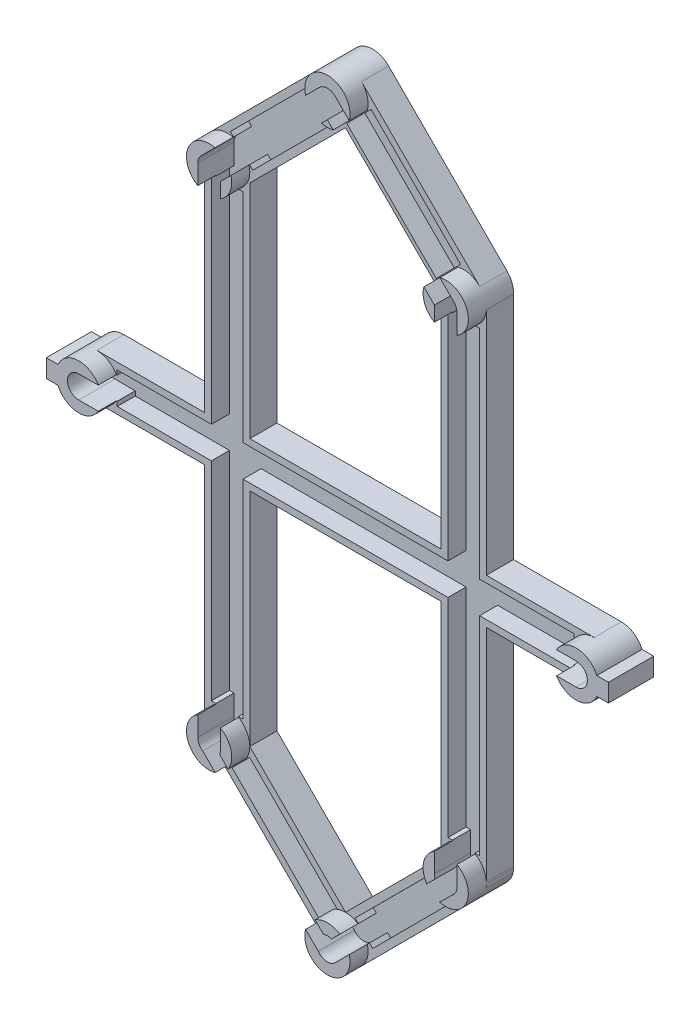
from build123d import *
from build123d.topology import SkipClean

# Parameters (mm, degrees)
SKETCH_1_R                       = 5
SKETCH_1_R_2                     = 2.5
EXTRUDE_1_DEPTH                  = 10
EXTRUDE_1_2_DEPTH                = 10
EXTRUDE_1_3_DEPTH                = 10
EXTRUDE_1_4_DEPTH                = 10
EXTRUDE_1_5_DEPTH                = 10
EXTRUDE_1_6_DEPTH                = 10
EXTRUDE_2_DEPTH                  = 6
EXTRUDE_4_DEPTH                  = 6
CUT_EXTRUDE_1_DEPTH              = 4
SKETCH_5_R                       = 3.75
SKETCH_5_R_2                     = 2.5
EXTRUDE_3_DEPTH                  = 2
CUT_EXTRUDE_2_DEPTH              = 4
CUT_EXTRUDE_3_DEPTH              = 8
SKETCH_11_R                      = 2.5
EXTRUDE_9_DEPTH                  = 2
AUFSATZ_LINEAR_AUSTRAGEN1_DEPTH  = 6
SKIZZE4_W                        = 5
SKIZZE4_H                        = 59.806963929
SCHNITT_LINEAR_AUSTRAGEN1_DEPTH  = 8
SCHNITT_LINEAR_AUSTRAGEN2_DEPTH  = 8
SCHNITT_LINEAR_AUSTRAGEN3_DEPTH  = 8
SCHNITT_LINEAR_AUSTRAGEN6_DEPTH  = 8
SKIZZE9_W                        = 5
SKIZZE9_H                        = 50.316023812
SCHNITT_LINEAR_AUSTRAGEN8_DEPTH  = 8
SCHNITT_LINEAR_START             = -4
SCHNITT_LINEAR_AUSTRAGEN9_DEPTH  = 4
SKIZZE11_W                       = 110
SKIZZE11_H                       = 10
AUFSATZ_LINEAR_AUSTRAGEN2_DEPTH  = 6
SKIZZE12_R                       = 5
SKIZZE12_R_2                     = 2.5
AUFSATZ_LINEAR_AUSTRAGEN4_DEPTH  = 10
SCHNITT_LINEAR_AUSTRAGEN10_DEPTH = 8
AUFSATZ_LINEAR_AUSTRAGEN5_DEPTH  = 2
SKIZZE17_W                       = 3
SKIZZE17_H                       = 4
AUFSATZ_LINEAR_AUSTRAGEN6_DEPTH  = 10
SKIZZE18_W                       = 100.99044
SKIZZE18_H                       = 7
SCHNITT_LINEAR_AUSTRAGEN11_DEPTH = 4
SKIZZE19_W                       = 7
SKIZZE19_H                       = 101
SKIZZE19_W_2                     = 6.995164391
SCHNITT_LINEAR_AUSTRAGEN12_DEPTH = 4
SCHNITT_LINEAR_AUSTRAGEN13_DEPTH = 4
SCHNITT_LINEAR_AUSTRAGEN14_DEPTH = 4


with BuildPart() as part:
    # Эскиз1 → Бобышка-Вытянуть1 (new body)
    with BuildSketch(Plane.XY):
        with Locations((-12.085916667, 54.294857344)):
            Circle(SKETCH_1_R)
        with Locations((-12.085916667, 54.294857344)):
            Circle(SKETCH_1_R_2, mode=Mode.SUBTRACT)
    extrude(amount=EXTRUDE_1_DEPTH)



with BuildPart() as body_2:
    # Эскиз1 → Extrude 1 2 (new body)
    with BuildSketch(Plane.XY):
        with Locations((-38.24886757, 28.13190644)):
            Circle(SKETCH_1_R)
        with Locations((-38.24886757, 28.13190644)):
            Circle(SKETCH_1_R_2, mode=Mode.SUBTRACT)
    extrude(amount=EXTRUDE_1_2_DEPTH)


with BuildPart() as body_3:
    # Эскиз1 → Extrude 1 3 (new body)
    with BuildSketch(Plane.XY):
        with Locations((14.077034237, 28.13190644)):
            Circle(SKETCH_1_R)
        with Locations((14.077034237, 28.13190644)):
            Circle(SKETCH_1_R_2, mode=Mode.SUBTRACT)
    extrude(amount=EXTRUDE_1_3_DEPTH)


with BuildPart() as body_4:
    # Эскиз1 → Extrude 1 4 (new body)
    with BuildSketch(Plane.XY):
        with Locations((-38.24886757, -81.86809356)):
            Circle(SKETCH_1_R)
        with Locations((-38.24886757, -81.86809356)):
            Circle(SKETCH_1_R_2, mode=Mode.SUBTRACT)
    extrude(amount=EXTRUDE_1_4_DEPTH)


with BuildPart() as body_5:
    # Эскиз1 → Extrude 1 5 (new body)
    with BuildSketch(Plane.XY):
        with Locations((14.077034237, -81.86809356)):
            Circle(SKETCH_1_R)
        with Locations((14.077034237, -81.86809356)):
            Circle(SKETCH_1_R_2, mode=Mode.SUBTRACT)
    extrude(amount=EXTRUDE_1_5_DEPTH)


with BuildPart() as body_6:
    # Эскиз1 → Extrude 1 6 (new body)
    with BuildSketch(Plane.XY):
        with Locations((-12.085916667, -108.031044464)):
            Circle(SKETCH_1_R)
        with Locations((-12.085916667, -108.031044464)):
            Circle(SKETCH_1_R_2, mode=Mode.SUBTRACT)
    extrude(amount=EXTRUDE_1_6_DEPTH)


with BuildPart() as part_1:
    add(part.part)

    add(body_2.part)  # Бобышка-Вытянуть2 merges body 2
    # Эскиз3 → Бобышка-Вытянуть2 (add)
    with BuildSketch(Plane(origin=(0, 0, 0), x_dir=(-1, 0, 0), z_dir=(0, 0, -1))):
        Polygon((12.085916667, 54.294857344), (15.621450572, 57.83039125), (41.784401476, 31.667440346), (34.713333665, 24.596372534), (8.550382761, 50.759323438), align=None)
    extrude(amount=-EXTRUDE_2_DEPTH)


    add(body_3.part)  # Бобышка-Вытянуть4 merges body 3
    # Эскиз9 → Бобышка-Вытянуть4 (add)
    with BuildSketch(Plane(origin=(0, 0, 0), x_dir=(-1, 0, 0), z_dir=(0, 0, -1))):
        Polygon((-14.077034237, 28.13190644), (-17.612568143, 31.667440346), (8.550382761, 57.83039125), (15.621450572, 50.759323438), (-10.541500331, 24.596372534), align=None)
    extrude(amount=-EXTRUDE_4_DEPTH)

    # Эскиз4 → Вырез-Вытянуть1 (cut)
    with BuildSketch(Plane.XY.offset(6)):
        Polygon((-13.85368362, 56.062624297), (-10.318149714, 52.527090391), (-36.481100617, 26.364139487), (-40.016634523, 29.899673393), align=None)
    extrude(amount=-CUT_EXTRUDE_1_DEPTH, mode=Mode.SUBTRACT)

    # Эскиз5 → Бобышка-Вытянуть3 (add)
    with BuildSketch(Plane(origin=(0, 0, 0), x_dir=(-1, 0, 0), z_dir=(0, 0, -1))):
        with Locations((12.969800143, 55.178740821)):
            Circle(SKETCH_5_R)
        with Locations((38.24886757, 28.13190644)):
            Circle(SKETCH_5_R_2)
    extrude(amount=-EXTRUDE_3_DEPTH)

    # Эскиз4<2> → Вырез-Вытянуть2 (cut)
    with BuildSketch(Plane.XY.offset(6)):
        Polygon((-13.85368362, 56.062624297), (-10.318149714, 52.527090391), (-36.481100617, 26.364139487), (-40.016634523, 29.899673393), align=None)
    extrude(amount=CUT_EXTRUDE_2_DEPTH, mode=Mode.SUBTRACT)

    # Эскиз10 → Вырез-Вытянуть3 (cut)
    with BuildSketch(Plane.XY.offset(10)):
        Polygon((14.077034237, 28.13190644), (12.309267284, 26.364139487), (-13.85368362, 52.527090391), (-12.085916667, 54.294857344), (-10.318149714, 56.062624297), (15.84480119, 29.899673393), align=None)
    extrude(amount=-CUT_EXTRUDE_3_DEPTH, mode=Mode.SUBTRACT)

    # Эскиз11 → Бобышка-Вытянуть9 (add)
    with BuildSketch(Plane(origin=(0, 0, 0), x_dir=(-1, 0, 0), z_dir=(0, 0, -1))):
        with Locations((-14.077034237, 28.13190644)):
            Circle(SKETCH_11_R)
    extrude(amount=-EXTRUDE_9_DEPTH)


    add(body_4.part)  # Aufsatz-Linear austragen1 merges body 4

    add(body_5.part)  # Aufsatz-Linear austragen1 merges body 5

    add(body_6.part)  # Aufsatz-Linear austragen1 merges body 6
    # Skizze2 → Aufsatz-Linear austragen1 (add)
    with BuildSketch(Plane(origin=(0, 0, 0), x_dir=(-1, 0, 0), z_dir=(0, 0, -1))):
        with BuildLine():
            Line((-19.072198628, 27.912059415), (-19.072198628, -82.053028128))
            ThreePointArc((-19.072198628, -82.053028128), (-19.041306546, -82.52636895), (-18.949154393, -82.991679422))
            Line((-18.949154393, -82.991679422), (-17.963470151, -85.013823346))
            Line((-17.963470151, -85.013823346), (8.550382761, -111.56657837))
            Line((8.550382761, -111.56657837), (15.621450572, -111.56657837))
            Line((15.621450572, -111.56657837), (41.784377989, -85.403650953))
            Line((41.784377989, -85.403650953), (43.24886757, -81.86809356))
            Line((43.24886757, -81.86809356), (43.24886757, 28.13190644))
            Line((43.24886757, 28.13190644), (33.24886757, 26.060838628))
            Line((33.24886757, 26.060838628), (33.24886757, -81.86809356))
            Line((33.24886757, -81.86809356), (12.085916667, -103.031044464))
            Line((12.085916667, -103.031044464), (-9.077034237, -81.86809356))
            Line((-9.077034237, -81.86809356), (-9.077034237, 26.060838628))
            Line((-9.077034237, 26.060838628), (-19.072198628, 27.912059415))
        make_face()
    extrude(amount=-AUFSATZ_LINEAR_AUSTRAGEN1_DEPTH)

    # Skizze4 → Schnitt-Linear austragen1 (cut)
    with SkipClean():  # the faces are left unmerged after this step: merging them gives an invalid solid
        with BuildSketch(Plane.XY.offset(10)):
            with Locations((14.077034237, -51.964611596)):
                Rectangle(SKIZZE4_W, SKIZZE4_H)
        extrude(amount=-SCHNITT_LINEAR_AUSTRAGEN1_DEPTH, mode=Mode.SUBTRACT)

    # Skizze5 → Schnitt-Linear austragen2 (cut)
    with SkipClean():  # the faces are left unmerged after this step: merging them gives an invalid solid
        with BuildSketch(Plane.XY.offset(10)):
            Polygon((-38.24886757, -81.86809356), (-35.74886757, -81.86809356), (-35.74886757, 28.13190644), (-40.74886757, 28.13190644), (-40.74886757, -81.86809356), align=None)
        extrude(amount=-SCHNITT_LINEAR_AUSTRAGEN2_DEPTH, mode=Mode.SUBTRACT)

    # Skizze6 → Schnitt-Linear austragen3 (cut)
    with SkipClean():  # the faces are left unmerged after this step: merging them gives an invalid solid
        with BuildSketch(Plane.XY.offset(10)):
            Polygon((-12.815807368, -107.346754653), (13.705976866, -80.786054714), (16.182664308, -83.25911341), (-10.339119925, -109.819813349), align=None)
        extrude(amount=-SCHNITT_LINEAR_AUSTRAGEN3_DEPTH, mode=Mode.SUBTRACT)

    # Skizze8 → Schnitt-Linear austragen6 (cut)
    with SkipClean():  # the faces are left unmerged after this step: merging them gives an invalid solid
        with BuildSketch(Plane.XY.offset(10)):
            Polygon((-37.36882645, -81.283668587), (-11.186213036, -107.466282), (-13.66108677, -109.941155734), (-39.843700184, -83.758542321), align=None)
        extrude(amount=-SCHNITT_LINEAR_AUSTRAGEN6_DEPTH, mode=Mode.SUBTRACT)

    # Skizze9 → Schnitt-Linear austragen8 (cut)
    with SkipClean():  # the faces are left unmerged after this step: merging them gives an invalid solid
        with BuildSketch(Plane.XY.offset(10)):
            with Locations((14.077034237, 3.096882275)):
                Rectangle(SKIZZE9_W, SKIZZE9_H)
        extrude(amount=-SCHNITT_LINEAR_AUSTRAGEN8_DEPTH, mode=Mode.SUBTRACT)

    # Skizze10 → Schnitt-Linear austragen9 (cut)
    with SkipClean():  # the faces are left unmerged after this step: merging them gives an invalid solid
        with BuildSketch(Plane.XY.offset(6).offset(SCHNITT_LINEAR_START)):
            with BuildLine():
                Line((11.73971842, -82.755198272), (12.625523382, -81.86809356))
                Line((12.625523382, -81.86809356), (11.577034237, -81.86809356))
                ThreePointArc((11.577034237, -81.86809356), (11.618041604, -82.319042813), (11.73971842, -82.755198272))
            make_face()
            with BuildLine():
                Line((14.789603399, -81.86809356), (16.165610189, -83.242084278))
                ThreePointArc((16.165610189, -83.242084278), (16.47197055, -82.585226784), (16.577034237, -81.86809356))
                Line((16.577034237, -81.86809356), (14.789603399, -81.86809356))
            make_face()
            with BuildLine():
                Line((-12.962669252, -105.689825784), (-12.061327404, -106.591167632))
                Line((-12.061327404, -106.591167632), (-11.174544697, -105.70308374))
                ThreePointArc((-11.174544697, -105.70308374), (-12.067381058, -105.531113178), (-12.962669252, -105.689825784))
            make_face()
            with BuildLine():
                Line((-11.940605372, -108.220674336), (-13.66108677, -109.941155734))
                Line((-13.66108677, -109.941155734), (-14.125547986, -109.476694519))
                ThreePointArc((-14.125547986, -109.476694519), (-12.311454174, -110.520850246), (-10.339260463, -109.819673018))
                Line((-10.339260463, -109.819673018), (-11.940605372, -108.220674336))
            make_face()
            with BuildLine():
                Line((-39.843700184, -83.758542321), (-37.953251423, -81.86809356))
                Line((-37.953251423, -81.86809356), (-40.74886757, -81.86809356))
                ThreePointArc((-40.74886757, -81.86809356), (-40.46969232, -83.01610812), (-39.694517625, -83.907724879))
                Line((-39.694517625, -83.907724879), (-39.843700184, -83.758542321))
            make_face()
            with BuildLine():
                Line((-36.784401476, -81.86809356), (-35.907648891, -82.744846145))
                ThreePointArc((-35.907648891, -82.744846145), (-35.78888315, -82.313600744), (-35.74886757, -81.86809356))
                Line((-35.74886757, -81.86809356), (-36.784401476, -81.86809356))
            make_face()
        extrude(amount=SCHNITT_LINEAR_AUSTRAGEN9_DEPTH, mode=Mode.SUBTRACT)

    # Skizze11 → Aufsatz-Linear austragen2 (add)
    with SkipClean():  # the faces are left unmerged after this step: merging them gives an invalid solid
        with BuildSketch(Plane(origin=(0, 0, 0), x_dir=(-1, 0, 0), z_dir=(0, 0, -1))):
            with Locations((12.085916667, -27.903627466)):
                Rectangle(SKIZZE11_W, SKIZZE11_H)
        extrude(amount=-AUFSATZ_LINEAR_AUSTRAGEN2_DEPTH)

    # Skizze12 → Aufsatz-Linear austragen4 (add)
    # profile 1 of 2: a face of its own
    with SkipClean():  # the faces are left unmerged after this step: merging them gives an invalid solid
        with BuildSketch(Plane(origin=(0, 0, 0), x_dir=(-1, 0, 0), z_dir=(0, 0, -1))):
            with Locations((-42.914083333, -27.903627466)):
                Circle(SKIZZE12_R)
            with Locations((-42.914083333, -27.903627466)):
                Circle(SKIZZE12_R_2, mode=Mode.SUBTRACT)
        # profile 2 of 2: a face of its own
        with BuildSketch(Plane(origin=(0, 0, 0), x_dir=(-1, 0, 0), z_dir=(0, 0, -1))):
            with Locations((67.085916667, -27.903627466)):
                Circle(SKIZZE12_R)
            with Locations((67.085916667, -27.903627466)):
                Circle(SKIZZE12_R_2, mode=Mode.SUBTRACT)
        extrude(amount=-AUFSATZ_LINEAR_AUSTRAGEN4_DEPTH)

    # Skizze15 → Schnitt-Linear austragen10 (cut)
    with SkipClean():  # the faces are left unmerged after this step: merging them gives an invalid solid
        with BuildSketch(Plane.XY.offset(10)):
            Polygon((42.914083333, -30.403627466), (16.602031436, -30.403627466), (16.577034237, -32.903627466), (11.577034237, -32.903627466), (11.577034237, -30.403627466), (-35.74886757, -30.403627466), (-35.74886757, -32.903627466), (-40.74886757, -32.903627466), (-40.74886757, -30.403627466), (-67.085916667, -30.403627466), (-67.085916667, -25.403627466), (-40.74886757, -25.403627466), (-40.74886757, -22.903627466), (-35.74886757, -22.903627466), (-35.74886757, -25.403627466), (11.577034237, -25.403627466), (11.577034237, -22.903627466), (16.577034237, -22.903627466), (16.577034237, -25.403627466), (42.914083333, -25.403627466), align=None)
        extrude(amount=-SCHNITT_LINEAR_AUSTRAGEN10_DEPTH, mode=Mode.SUBTRACT)

    # Skizze16 → Aufsatz-Linear austragen5 (add)
    with SkipClean():  # the faces are left unmerged after this step: merging them gives an invalid solid
        with BuildSketch(Plane(origin=(0, 0, 0), x_dir=(-1, 0, 0), z_dir=(0, 0, -1))):
            with BuildLine():
                Line((67.085916667, -30.403627466), (67.085916667, -25.403627466))
                ThreePointArc((67.085916667, -25.403627466), (69.585916667, -27.903627466), (67.085916667, -30.403627466))
            make_face()
            with BuildLine():
                Line((-42.914083333, -25.403627466), (-42.914083333, -30.403627466))
                ThreePointArc((-42.914083333, -30.403627466), (-45.414083333, -27.903627466), (-42.914083333, -25.403627466))
            make_face()
        extrude(amount=-AUFSATZ_LINEAR_AUSTRAGEN5_DEPTH)

    # Skizze17 → Aufsatz-Linear austragen6 (add)
    with SkipClean():  # the faces are left unmerged after this step: merging them gives an invalid solid
        with BuildSketch(Plane(origin=(0, 0, 0), x_dir=(-1, 0, 0), z_dir=(0, 0, -1))):
            with Locations((-48.572198628, -27.903627466)):
                Rectangle(SKIZZE17_W, SKIZZE17_H)
            with Locations((72.74886757, -27.903627466)):
                Rectangle(SKIZZE17_W, SKIZZE17_H)
        extrude(amount=-AUFSATZ_LINEAR_AUSTRAGEN6_DEPTH)

    # Skizze18 → Schnitt-Linear austragen11 (cut)
    with SkipClean():  # the faces are left unmerged after this step: merging them gives an invalid solid
        with BuildSketch(Plane.XY.offset(6)):
            with Locations((-12.081136667, -27.903627466)):
                Rectangle(SKIZZE18_W, SKIZZE18_H)
        extrude(amount=-SCHNITT_LINEAR_AUSTRAGEN11_DEPTH, mode=Mode.SUBTRACT)

    # Skizze19 → Schnitt-Linear austragen12 (cut)
    with SkipClean():  # the faces are left unmerged after this step: merging them gives an invalid solid
        with BuildSketch(Plane.XY.offset(6)):
            with Locations((-38.24886757, -26.86809356)):
                Rectangle(SKIZZE19_W, SKIZZE19_H)
            with Locations((14.074616433, -26.86809356)):
                Rectangle(SKIZZE19_W_2, SKIZZE19_H)
        extrude(amount=-SCHNITT_LINEAR_AUSTRAGEN12_DEPTH, mode=Mode.SUBTRACT)

    # Skizze20 → Schnitt-Linear austragen13 (cut)
    with SkipClean():  # the faces are left unmerged after this step: merging them gives an invalid solid
        with BuildSketch(Plane.XY.offset(6)):
            Polygon((13.354880213, -87.506298233), (-6.07628823, -106.965978242), (-9.968225639, -103.079743149), (9.462942803, -83.620063139), align=None)
            Polygon((-33.273993836, -83.964287638), (-13.828557354, -103.40972412), (-17.742770916, -107.323937683), (-37.188207399, -87.8785012), align=None)
        extrude(amount=-SCHNITT_LINEAR_AUSTRAGEN13_DEPTH, mode=Mode.SUBTRACT)

    # Skizze21 → Schnitt-Linear austragen14 (cut)
    with SkipClean():  # the faces are left unmerged after this step: merging them gives an invalid solid
        with BuildSketch(Plane.XY.offset(6)):
            Polygon((-11.81211466, 48.20469832), (7.986875214, 28.405708447), (13.369927456, 33.78876069), (-6.429062417, 53.587750563), align=None)
            Polygon((-17.742770916, 53.587750563), (-12.793023448, 48.638003095), (-32.592013321, 28.839013221), (-37.541760789, 33.78876069), align=None)
        extrude(amount=-SCHNITT_LINEAR_AUSTRAGEN14_DEPTH, mode=Mode.SUBTRACT)


solid = part_1.part
